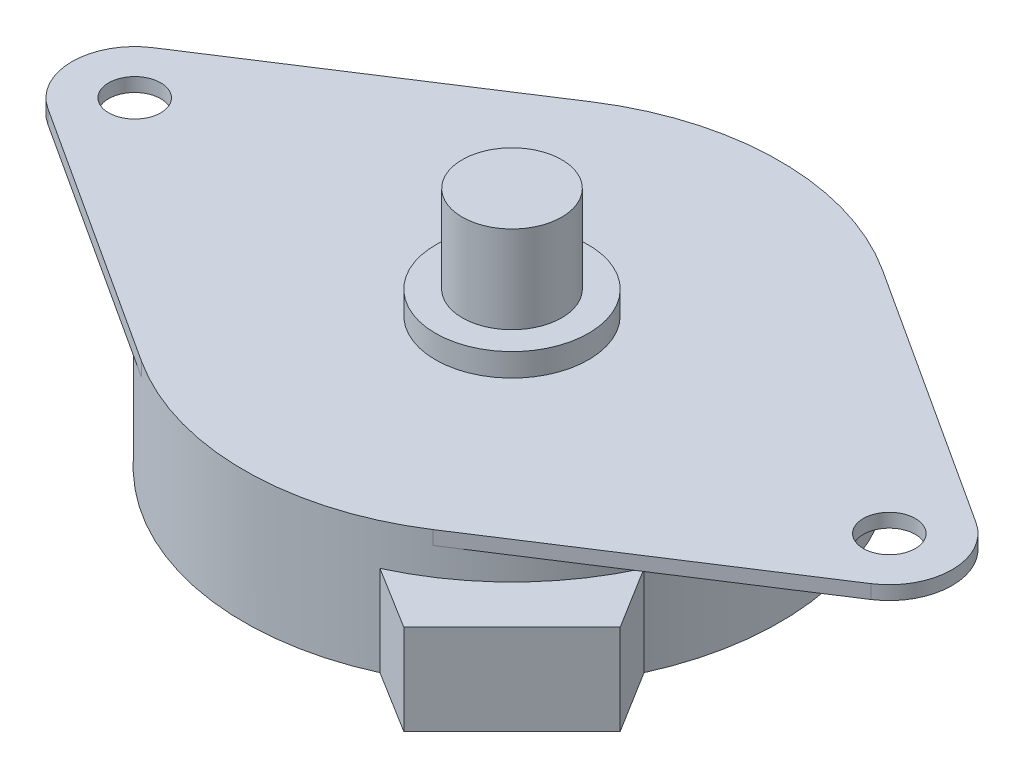
from build123d import *
from build123d.topology import SkipClean

# Parameters (mm, degrees)
SKETCH1_R      = 4.1
SKETCH1_R_2    = 1.7
EXTRUDE1_DEPTH = 0.9
EXTRUDE2_START = 7.7
SKETCH2_R      = 17.5
EXTRUDE2_DEPTH = 7.7
SKETCH3_R      = 5
EXTRUDE3_DEPTH = 1.5
SKETCH4_R      = 3.25
EXTRUDE4_DEPTH = 5.7
EXTRUDE5_DEPTH = 5.9


with BuildPart() as part:
    # Sketch1 → Extrude1 (new body)
    # profile 1 of 8: a face of its own
    with BuildSketch(Plane(origin=(0, 0, 0), x_dir=(1, 0, 0), z_dir=(0, 1, 0))):
        with BuildLine():
            ThreePointArc((-9.513184584, -14.688407642), (-17.5, 0), (-9.513184584, 14.688407642))
            Line((-9.513184584, 14.688407642), (-26.878803245, 3.441284076))
            ThreePointArc((-26.878803245, 3.441284076), (-22.691441002, 3.601950396), (-20.55, 0))
            ThreePointArc((-20.55, 0), (-22.691441002, -3.601950396), (-26.878803245, -3.441284076))
            Line((-26.878803245, -3.441284076), (-9.513184584, -14.688407642))
        make_face()
    # profile 2 of 8: a face of its own
    with BuildSketch(Plane(origin=(0, 0, 0), x_dir=(1, 0, 0), z_dir=(0, 1, 0))):
        with Locations((-24.65, 0)):
            Circle(SKETCH1_R)
        with Locations(Location((-24.65, 0, 0), (0, 0, 270))):
            Circle(SKETCH1_R_2, mode=Mode.SUBTRACT)
    # profile 3 of 8: a face of its own
    with BuildSketch(Plane(origin=(0, 0, 0), x_dir=(1, 0, 0), z_dir=(0, 1, 0))):
        with BuildLine():
            ThreePointArc((9.513184584, 14.688407642), (4.959983178, 16.782388593), (0, 17.5))
            Line((0, 17.5), (0, -17.5))
            ThreePointArc((0, -17.5), (4.959983178, -16.782388593), (9.513184584, -14.688407642))
            ThreePointArc((9.513184584, -14.688407642), (15.374178518, -8.359703038), (17.5, 0))
            ThreePointArc((17.5, 0), (15.374178518, 8.359703038), (9.513184584, 14.688407642))
        make_face()
    # profile 4 of 8: a face of its own
    with BuildSketch(Plane(origin=(0, 0, 0), x_dir=(1, 0, 0), z_dir=(0, 1, 0))):
        with BuildLine():
            Line((0, -17.5), (0, 17.5))
            ThreePointArc((0, 17.5), (-4.959983178, 16.782388593), (-9.513184584, 14.688407642))
            ThreePointArc((-9.513184584, 14.688407642), (-17.5, 0), (-9.513184584, -14.688407642))
            ThreePointArc((-9.513184584, -14.688407642), (-4.959983178, -16.782388593), (0, -17.5))
        make_face()
    # profile 5 of 8: a face of its own
    with BuildSketch(Plane(origin=(0, 0, 0), x_dir=(1, 0, 0), z_dir=(0, 1, 0))):
        with BuildLine():
            ThreePointArc((9.513184584, 14.688407642), (4.959983178, 16.782388593), (0, 17.5))
            Line((0, 17.5), (0, -17.5))
            ThreePointArc((0, -17.5), (4.959983178, -16.782388593), (9.513184584, -14.688407642))
            ThreePointArc((9.513184584, -14.688407642), (15.374178518, -8.359703038), (17.5, 0))
            ThreePointArc((17.5, 0), (15.374178518, 8.359703038), (9.513184584, 14.688407642))
        make_face()
    # profile 6 of 8: a face of its own
    with BuildSketch(Plane(origin=(0, 0, 0), x_dir=(1, 0, 0), z_dir=(0, 1, 0))):
        with BuildLine():
            Line((0, -17.5), (0, 17.5))
            ThreePointArc((0, 17.5), (-4.959983178, 16.782388593), (-9.513184584, 14.688407642))
            ThreePointArc((-9.513184584, 14.688407642), (-17.5, 0), (-9.513184584, -14.688407642))
            ThreePointArc((-9.513184584, -14.688407642), (-4.959983178, -16.782388593), (0, -17.5))
        make_face()
    # profile 7 of 8: a face of its own
    with BuildSketch(Plane(origin=(0, 0, 0), x_dir=(1, 0, 0), z_dir=(0, 1, 0))):
        with BuildLine():
            Line((26.878803245, 3.441284076), (9.513184584, 14.688407642))
            ThreePointArc((9.513184584, 14.688407642), (15.374178518, 8.359703038), (17.5, 0))
            ThreePointArc((17.5, 0), (15.374178518, -8.359703038), (9.513184584, -14.688407642))
            Line((9.513184584, -14.688407642), (26.878803245, -3.441284076))
            ThreePointArc((26.878803245, -3.441284076), (20.55, 0), (26.878803245, 3.441284076))
        make_face()
    # profile 8 of 8: a face of its own
    with BuildSketch(Plane(origin=(0, 0, 0), x_dir=(1, 0, 0), z_dir=(0, 1, 0))):
        with Locations((24.65, 0)):
            Circle(SKETCH1_R)
        with Locations(Location((24.65, 0, 0), (0, 0, 270))):
            Circle(SKETCH1_R_2, mode=Mode.SUBTRACT)
    extrude(amount=EXTRUDE1_DEPTH)

    # Sketch2 → Extrude2 (add)
    with SkipClean():  # the faces are left unmerged after this step: merging them gives an invalid solid
        with BuildSketch(Plane.XZ.offset(EXTRUDE2_START)):
            with Locations(Location((0, 0, 0), (0, 0, 270))):
                Circle(SKETCH2_R)
        extrude(amount=-EXTRUDE2_DEPTH)

    # Sketch3 → Extrude3 (add)
    with SkipClean():  # the faces are left unmerged after this step: merging them gives an invalid solid
        with BuildSketch(Plane(origin=(0, 0.9, 0), x_dir=(1, 0, 0), z_dir=(0, 1, 0))):
            with Locations(Location((0, 0, 0), (0, 0, 270))):
                Circle(SKETCH3_R)
        extrude(amount=EXTRUDE3_DEPTH)

    # Sketch4 → Extrude4 (add)
    with SkipClean():  # the faces are left unmerged after this step: merging them gives an invalid solid
        with BuildSketch(Plane(origin=(0, 2.4, 0), x_dir=(1, 0, 0), z_dir=(0, 1, 0))):
            with Locations(Location((0, 0, 0), (0, 0, 270))):
                Circle(SKETCH4_R)
        extrude(amount=EXTRUDE4_DEPTH)

    # Sketch5 → Extrude5 (add)
    with BuildSketch(Plane.XZ.offset(7.7)):
        Polygon((7.284924369, 15.911627099), (15.911627099, 7.284924369), (18.457211511, 11.3861437), (11.3861437, 18.457211511), align=None)
    extrude(amount=-EXTRUDE5_DEPTH)


solid = part.part
